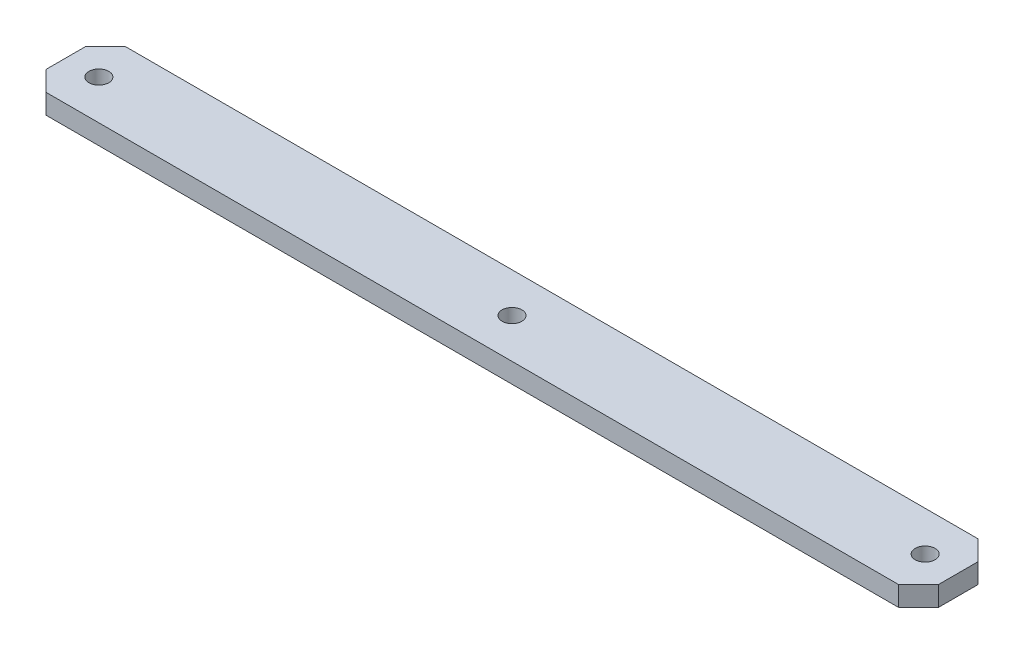
from build123d import *

# Parameters (mm, degrees)
SKETCH1_R           = 1.5
BOSS_EXTRUDE1_DEPTH = 3


with BuildPart() as part:
    # Sketch1 → Boss-Extrude1 (new body)
    with BuildSketch(Plane(origin=(0, 0, 0), x_dir=(1, 0, 0), z_dir=(0, 1, 0))):
        Polygon((-67.5, 3), (-64.5, 6), (64.5, 6), (67.5, 3), (67.5, -3), (64.5, -6), (-64.5, -6), (-67.5, -3), align=None)
        with Locations(Location((-62.5, 0, 0), (0, 0, 270))):
            Circle(SKETCH1_R, mode=Mode.SUBTRACT)
        with Locations(Location((0, 0, 0), (0, 0, 270))):
            Circle(SKETCH1_R, mode=Mode.SUBTRACT)
        with Locations(Location((62.5, 0, 0), (0, 0, 270))):
            Circle(SKETCH1_R, mode=Mode.SUBTRACT)
    extrude(amount=BOSS_EXTRUDE1_DEPTH)


solid = part.part
